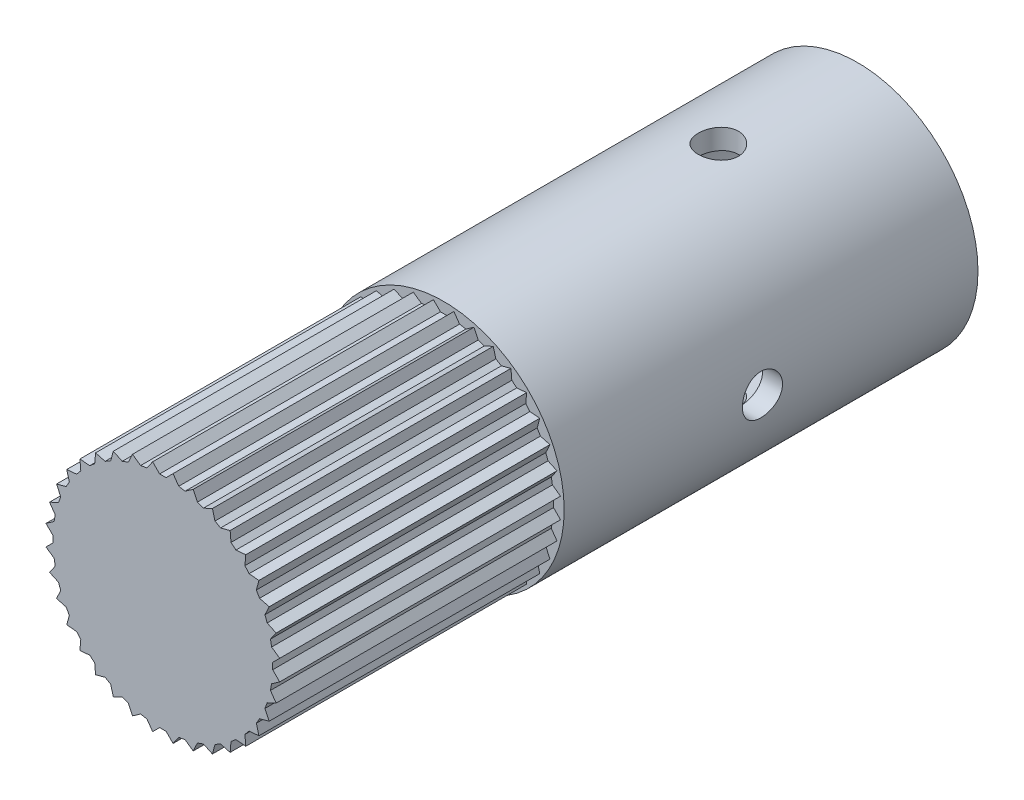
from build123d import *

# Parameters (mm, degrees)
SKETCH5_W               = 1.587499994
SKETCH5_H               = 54.90464
CUT_EXTRUDE5_DEPTH      = 79.234526804
CUT_EXTRUDE5_DEPTH_BACK = 79.234526804
SKETCH7_R               = 1.5875
CUT_EXTRUDE6_DEPTH      = 79.234526927
CUT_EXTRUDE6_DEPTH_BACK = 79.234526927
SKETCH6_R               = 1.5875
SKETCH10_R              = 7.9375
BOSS_EXTRUDE1_DEPTH     = 29.50464
CUT_EXTRUDE7_START      = 54.86908
SKETCH8_R               = 12.7
CUT_EXTRUDE7_DEPTH      = 25.4


with BuildPart() as part:
    # Sketch5 → Revolve2 (revolve)
    with BuildSketch(Plane(origin=(0, 0, 0), x_dir=(1, 0, 0), z_dir=(0, 1, 0)), mode=Mode.PRIVATE) as revolve2_sk:
        with Locations((8.731249997, -49.61382)):
            Rectangle(SKETCH5_W, SKETCH5_H)
    revolve(revolve2_sk.sketch.rotate(Axis((0, 0, 0), (0, 0, 1)), 180), axis=Axis((0, 0, 0), (0, 0, 1)))

    # Sketch7 → Cut-Extrude5 (cut, two sides: drawn at the far end of the back side and taken through both)
    with BuildSketch(Plane(origin=(0, 0, 0), x_dir=(0, 0, -1), z_dir=(1, 0, 0)).offset(-CUT_EXTRUDE5_DEPTH_BACK)):
        with Locations((-39.195999993, 0)):
            Circle(SKETCH7_R)
    extrude(amount=CUT_EXTRUDE5_DEPTH + CUT_EXTRUDE5_DEPTH_BACK, mode=Mode.SUBTRACT)

    # Sketch6 → Cut-Extrude6 (cut, two sides: drawn at the far end of the back side and taken through both)
    with BuildSketch(Plane(origin=(0, 0, 0), x_dir=(1, 0, 0), z_dir=(0, 1, 0)).offset(-CUT_EXTRUDE6_DEPTH_BACK)):
        with Locations(Location((1e-09, -33.163499999, 0), (0, 0, 269.999999955))):
            Circle(SKETCH6_R)
    extrude(amount=CUT_EXTRUDE6_DEPTH + CUT_EXTRUDE6_DEPTH_BACK, mode=Mode.SUBTRACT)

    # Sketch10 → Boss-Extrude1 (add)
    with BuildSketch(Plane(origin=(0, 0, 47.5615), x_dir=(-1, 0, 0), z_dir=(0, 0, -1))):
        Circle(SKETCH10_R)
    extrude(amount=-BOSS_EXTRUDE1_DEPTH)

    # Sketch8 → Cut-Extrude7 (cut)
    with BuildSketch(Plane.XY.offset(CUT_EXTRUDE7_START)):
        Circle(SKETCH8_R)
        Polygon((9.235721046, -0.808020891), (8.681700155, -0.254), (8.681700155, 0.254), (9.235721046, 0.808020891), (8.593912259, 1.257420242), (8.505698985, 1.75770258), (8.955098336, 2.399511367), (8.245002688, 2.730634406), (8.071256455, 3.207998257), (8.402379494, 3.918093905), (7.645572882, 4.120879625), (7.391572882, 4.56082053), (7.594358603, 5.317627141), (6.813836213, 5.385914002), (6.487300108, 5.775064579), (6.555586968, 6.555586968), (5.775064579, 6.487300108), (5.385914002, 6.813836213), (5.317627141, 7.594358603), (4.56082053, 7.391572882), (4.120879625, 7.645572882), (3.918093905, 8.402379494), (3.207998257, 8.071256455), (2.730634406, 8.245002688), (2.399511367, 8.955098336), (1.75770258, 8.505698985), (1.257420242, 8.593912259), (0.808020891, 9.235721046), (0.254, 8.681700155), (-0.254, 8.681700155), (-0.808020891, 9.235721046), (-1.257420242, 8.593912259), (-1.75770258, 8.505698985), (-2.399511367, 8.955098336), (-2.730634406, 8.245002688), (-3.207998257, 8.071256455), (-3.918093905, 8.402379494), (-4.120879625, 7.645572882), (-4.56082053, 7.391572882), (-5.317627141, 7.594358603), (-5.385914002, 6.813836213), (-5.775064579, 6.487300108), (-6.555586968, 6.555586968), (-6.487300108, 5.775064579), (-6.813836213, 5.385914002), (-7.594358603, 5.317627141), (-7.391572882, 4.56082053), (-7.645572882, 4.120879625), (-8.402379494, 3.918093905), (-8.071256455, 3.207998257), (-8.245002688, 2.730634406), (-8.955098336, 2.399511367), (-8.505698985, 1.75770258), (-8.593912259, 1.257420242), (-9.235721046, 0.808020891), (-8.681700155, 0.254), (-8.681700155, -0.254), (-9.235721046, -0.808020891), (-8.593912259, -1.257420242), (-8.505698985, -1.75770258), (-8.955098336, -2.399511367), (-8.245002688, -2.730634406), (-8.071256455, -3.207998257), (-8.402379494, -3.918093905), (-7.645572882, -4.120879625), (-7.391572882, -4.56082053), (-7.594358603, -5.317627141), (-6.813836213, -5.385914002), (-6.487300108, -5.775064579), (-6.555586968, -6.555586968), (-5.775064579, -6.487300108), (-5.385914002, -6.813836213), (-5.317627141, -7.594358603), (-4.56082053, -7.391572882), (-4.120879625, -7.645572882), (-3.918093905, -8.402379494), (-3.207998257, -8.071256455), (-2.730634406, -8.245002688), (-2.399511367, -8.955098336), (-1.75770258, -8.505698985), (-1.257420242, -8.593912259), (-0.808020891, -9.235721046), (-0.254, -8.681700155), (0.254, -8.681700155), (0.808020891, -9.235721046), (1.257420242, -8.593912259), (1.75770258, -8.505698985), (2.399511367, -8.955098336), (2.730634406, -8.245002688), (3.207998257, -8.071256455), (3.918093905, -8.402379494), (4.120879625, -7.645572882), (4.56082053, -7.391572882), (5.317627141, -7.594358603), (5.385914002, -6.813836213), (5.775064579, -6.487300108), (6.555586968, -6.555586968), (6.487300108, -5.775064579), (6.813836213, -5.385914002), (7.594358603, -5.317627141), (7.391572882, -4.56082053), (7.645572882, -4.120879625), (8.402379494, -3.918093905), (8.071256455, -3.207998257), (8.245002688, -2.730634406), (8.955098336, -2.399511367), (8.505698985, -1.75770258), (8.593912259, -1.257420242), align=None, mode=Mode.SUBTRACT)
    extrude(amount=CUT_EXTRUDE7_DEPTH, mode=Mode.SUBTRACT)


solid = part.part
